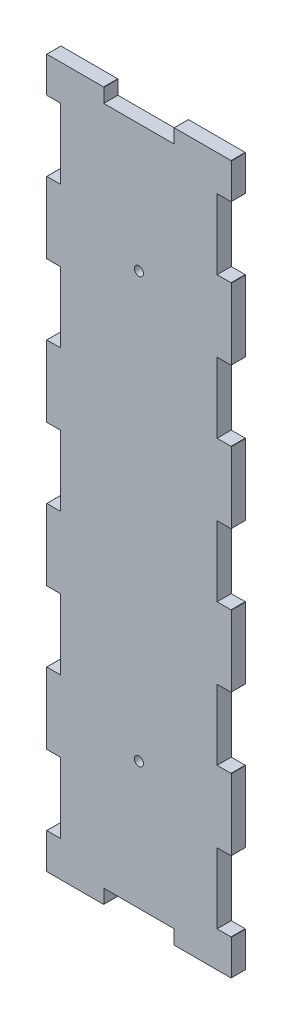
from build123d import *

# Parameters (mm, degrees)
BOSS_EXTRUDE1_DEPTH = 5
SKETCH1_R           = 1.6
CUT_EXTRUDE1_DEPTH  = 130.248833264


with BuildPart() as part:
    # Model → Boss-Extrude1 (new body)
    with BuildSketch(Plane.XY):
        Polygon((-12.44, -124.95), (-12.43, -124.94), (-12.42, -124.92), (-12.41, -124.91), (-12.4, -124.89), (-12.4, -119.97), (12.4, -119.97), (12.4, -124.89), (12.42, -124.93), (12.43, -124.94), (12.45, -124.95), (12.46, -124.96), (12.48, -124.97), (32.52, -124.97), (32.56, -124.95), (32.57, -124.94), (32.58, -124.92), (32.59, -124.91), (32.6, -124.89), (32.6, -112.48), (32.58, -112.44), (32.57, -112.43), (32.55, -112.42), (32.54, -112.41), (32.52, -112.4), (27.6, -112.4), (27.6, -87.6), (32.52, -87.6), (32.56, -87.58), (32.57, -87.57), (32.58, -87.55), (32.59, -87.54), (32.6, -87.52), (32.6, -62.48), (32.58, -62.44), (32.57, -62.43), (32.55, -62.42), (32.54, -62.41), (32.52, -62.4), (27.6, -62.4), (27.6, -37.6), (32.52, -37.6), (32.56, -37.58), (32.57, -37.57), (32.58, -37.55), (32.59, -37.54), (32.6, -37.52), (32.6, -12.48), (32.58, -12.44), (32.57, -12.43), (32.55, -12.42), (32.54, -12.41), (32.52, -12.4), (27.6, -12.4), (27.6, 12.4), (32.52, 12.4), (32.56, 12.42), (32.57, 12.43), (32.58, 12.45), (32.59, 12.46), (32.6, 12.48), (32.6, 37.52), (32.58, 37.56), (32.57, 37.57), (32.55, 37.58), (32.54, 37.59), (32.52, 37.6), (27.6, 37.6), (27.6, 62.4), (32.52, 62.4), (32.56, 62.42), (32.57, 62.43), (32.58, 62.45), (32.59, 62.46), (32.6, 62.48), (32.6, 87.52), (32.58, 87.56), (32.57, 87.57), (32.55, 87.58), (32.54, 87.59), (32.52, 87.6), (27.6, 87.6), (27.6, 112.4), (32.52, 112.4), (32.56, 112.42), (32.57, 112.43), (32.58, 112.45), (32.59, 112.46), (32.6, 112.48), (32.6, 124.89), (32.58, 124.93), (32.57, 124.94), (32.55, 124.95), (32.54, 124.96), (32.52, 124.97), (12.48, 124.97), (12.44, 124.95), (12.43, 124.94), (12.42, 124.92), (12.41, 124.91), (12.4, 124.89), (12.4, 119.97), (-12.4, 119.97), (-12.4, 124.89), (-12.42, 124.93), (-12.43, 124.94), (-12.45, 124.95), (-12.46, 124.96), (-12.48, 124.97), (-32.52, 124.97), (-32.56, 124.95), (-32.57, 124.94), (-32.58, 124.92), (-32.59, 124.91), (-32.6, 124.89), (-32.6, 112.48), (-32.58, 112.44), (-32.57, 112.43), (-32.55, 112.42), (-32.54, 112.41), (-32.52, 112.4), (-27.6, 112.4), (-27.6, 87.6), (-32.52, 87.6), (-32.56, 87.58), (-32.57, 87.57), (-32.58, 87.55), (-32.59, 87.54), (-32.6, 87.52), (-32.6, 62.48), (-32.58, 62.44), (-32.57, 62.43), (-32.55, 62.42), (-32.54, 62.41), (-32.52, 62.4), (-27.6, 62.4), (-27.6, 37.6), (-32.52, 37.6), (-32.56, 37.58), (-32.57, 37.57), (-32.58, 37.55), (-32.59, 37.54), (-32.6, 37.52), (-32.6, 12.48), (-32.58, 12.44), (-32.57, 12.43), (-32.55, 12.42), (-32.54, 12.41), (-32.52, 12.4), (-27.6, 12.4), (-27.6, -12.4), (-32.52, -12.4), (-32.56, -12.42), (-32.57, -12.43), (-32.58, -12.45), (-32.59, -12.46), (-32.6, -12.48), (-32.6, -37.52), (-32.58, -37.56), (-32.57, -37.57), (-32.55, -37.58), (-32.54, -37.59), (-32.52, -37.6), (-27.6, -37.6), (-27.6, -62.4), (-32.52, -62.4), (-32.56, -62.42), (-32.57, -62.43), (-32.58, -62.45), (-32.59, -62.46), (-32.6, -62.48), (-32.6, -87.52), (-32.58, -87.56), (-32.57, -87.57), (-32.55, -87.58), (-32.54, -87.59), (-32.52, -87.6), (-27.6, -87.6), (-27.6, -112.4), (-32.52, -112.4), (-32.56, -112.42), (-32.57, -112.43), (-32.58, -112.45), (-32.59, -112.46), (-32.6, -112.48), (-32.6, -124.89), (-32.58, -124.93), (-32.57, -124.94), (-32.55, -124.95), (-32.54, -124.96), (-32.52, -124.97), (-12.48, -124.97), align=None)
    extrude(amount=BOSS_EXTRUDE1_DEPTH)

    # Sketch1 → Cut-Extrude1 (cut, through all)
    with BuildSketch(Plane.XY.offset(5)):
        with Locations((0, 74.935)):
            Circle(SKETCH1_R)
        with Locations(Location((0, -74.935, 0), (0, 0, 180))):
            Circle(SKETCH1_R)
    extrude(amount=-CUT_EXTRUDE1_DEPTH, mode=Mode.SUBTRACT)


solid = part.part
